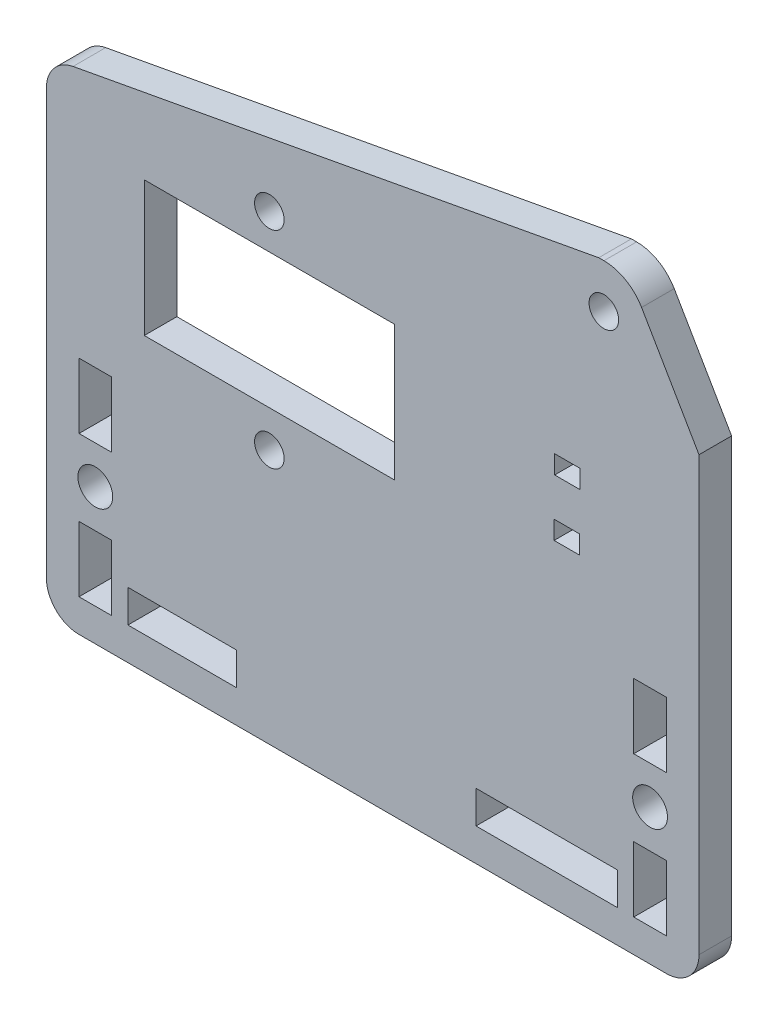
from build123d import *

# Parameters (mm, degrees)
SKETCH_1_R          = 1.359
SKETCH_1_W          = 3
SKETCH_1_H          = 6.001
SKETCH_1_W_2        = 10
SKETCH_1_H_2        = 3
SKETCH_1_W_3        = 12.999
SKETCH_1_W_4        = 2.329
SKETCH_1_H_3        = 1.693
SKETCH_1_W_5        = 23
SKETCH_1_H_4        = 12.399
EXTRUDE_1_DEPTH     = 3
SKETCH_2_R          = 1.6
CUT_EXTRUDE_1_DEPTH = 67.26469212


with BuildPart() as part:
    # 草图1 → 凸台-拉伸1 (new body)
    with BuildSketch(Plane(origin=(0, 0, 0), x_dir=(-1, 0, 0), z_dir=(0, 0, -1))):
        with BuildLine():
            Line((-57, -27.964431369), (-3, -27.964431369))
            ThreePointArc((-3, -27.964431369), (-0.878679656, -27.085751712), (0, -24.964431369))
            Line((0, -24.964431369), (0, 14.035588089))
            ThreePointArc((0, 14.035588089), (-0.693884476, 15.954397926), (-2.454554127, 16.985586191))
            Line((-2.454554127, 16.985586191), (-50.782638999, 25.921305316))
            Line((-50.782638999, 25.921305316), (-51.262778196, 25.921305316))
            ThreePointArc((-51.262778196, 25.921305316), (-53.258114674, 25.388095235), (-54.721484389, 23.930621486))
            Line((-54.721484389, 23.930621486), (-60, 14.844527968))
            Line((-60, 14.844527968), (-60, -24.964431369))
            ThreePointArc((-60, -24.964431369), (-59.121320344, -27.085751712), (-57, -27.964431369))
        make_face()
        with Locations(Location((-55.5, -15.464331369, 0), (0, 0, 180))):
            Circle(SKETCH_1_R, mode=Mode.SUBTRACT)
        with Locations(Location((-4.5, -15.464331369, 0), (0, 0, 180))):
            Circle(SKETCH_1_R, mode=Mode.SUBTRACT)
        with Locations(Location((-20.499, -4.535331369, 0), (0, 0, 180))):
            Circle(SKETCH_1_R, mode=Mode.SUBTRACT)
        with Locations(Location((-20.499, 14.465668631, 0), (0, 0, 180))):
            Circle(SKETCH_1_R, mode=Mode.SUBTRACT)
        with Locations(Location((-51.251, 21.869668631, 0), (0, 0, 180))):
            Circle(SKETCH_1_R, mode=Mode.SUBTRACT)
        with Locations((-4.501, -8.964831369)):
            Rectangle(SKETCH_1_W, SKETCH_1_H, mode=Mode.SUBTRACT)
        with Locations((-4.501, -21.963831369)):
            Rectangle(SKETCH_1_W, SKETCH_1_H, mode=Mode.SUBTRACT)
        with Locations((-55.5, -21.963831369)):
            Rectangle(SKETCH_1_W, SKETCH_1_H, mode=Mode.SUBTRACT)
        with Locations((-55.5, -8.964831369)):
            Rectangle(SKETCH_1_W, SKETCH_1_H, mode=Mode.SUBTRACT)
        with Locations((-12.5, -23.464331369)):
            Rectangle(SKETCH_1_W_2, SKETCH_1_H_2, mode=Mode.SUBTRACT)
        with Locations((-45.9995, -23.464331369)):
            Rectangle(SKETCH_1_W_3, SKETCH_1_H_2, mode=Mode.SUBTRACT)
        with Locations((-47.8955, 7.444168631)):
            Rectangle(SKETCH_1_W_4, SKETCH_1_H_3, mode=Mode.SUBTRACT)
        with Locations((-47.8435, 2.205168631)):
            Rectangle(SKETCH_1_W_4, SKETCH_1_H_3, mode=Mode.SUBTRACT)
        with Locations((-20.5, 5.035168631)):
            Rectangle(SKETCH_1_W_5, SKETCH_1_H_4, mode=Mode.SUBTRACT)
    extrude(amount=-EXTRUDE_1_DEPTH)

    # 草图2 → 切除-拉伸1 (cut, through all)
    with BuildSketch(Plane.XY.offset(3)):
        with Locations((55.5, -15.464331369)):
            Circle(SKETCH_2_R)
        with Locations((4.5, -15.464331369)):
            Circle(SKETCH_2_R)
    extrude(amount=-CUT_EXTRUDE_1_DEPTH, mode=Mode.SUBTRACT)


solid = part.part
